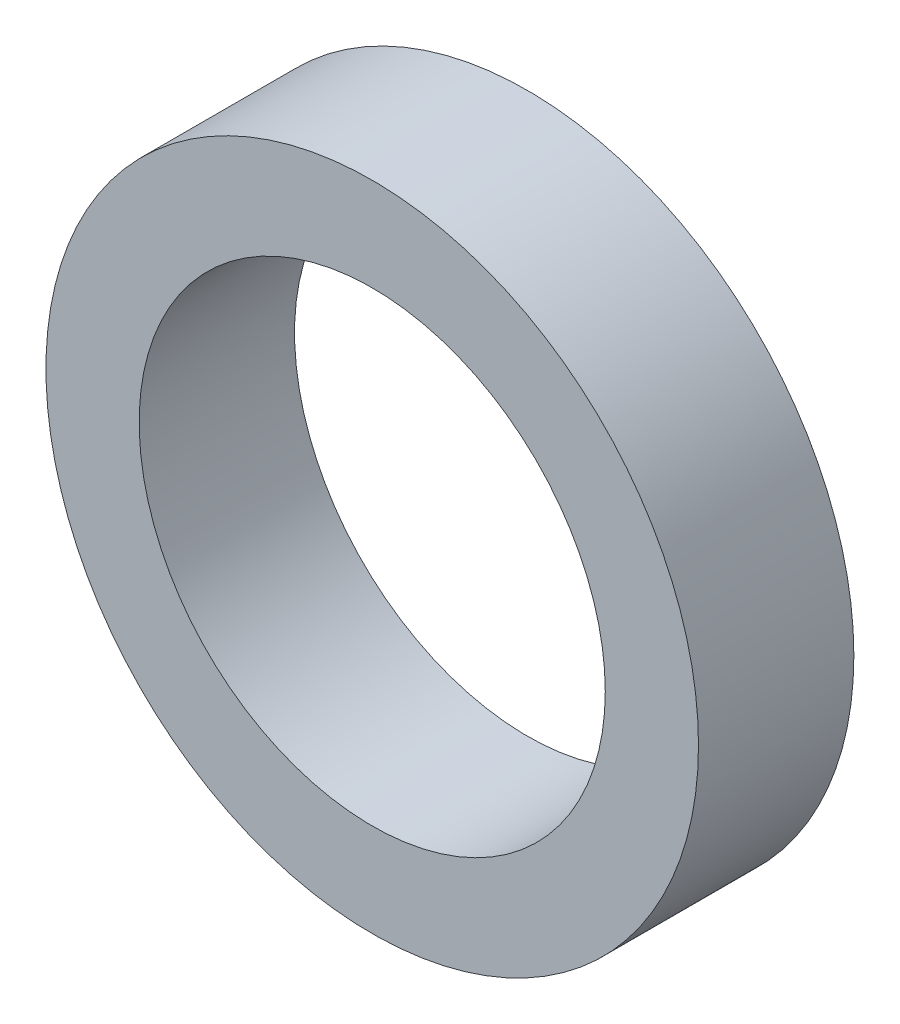
from build123d import *

# Parameters (mm, degrees)
SKETCH_1_R      = 10.5
SKETCH_1_R_2    = 7.5
EXTRUDE_1_DEPTH = 5


with BuildPart() as part:
    # 草图1 → 凸台-拉伸1 (new body)
    with BuildSketch(Plane.XY):
        Circle(SKETCH_1_R)
        Circle(SKETCH_1_R_2, mode=Mode.SUBTRACT)
    extrude(amount=EXTRUDE_1_DEPTH)


solid = part.part
